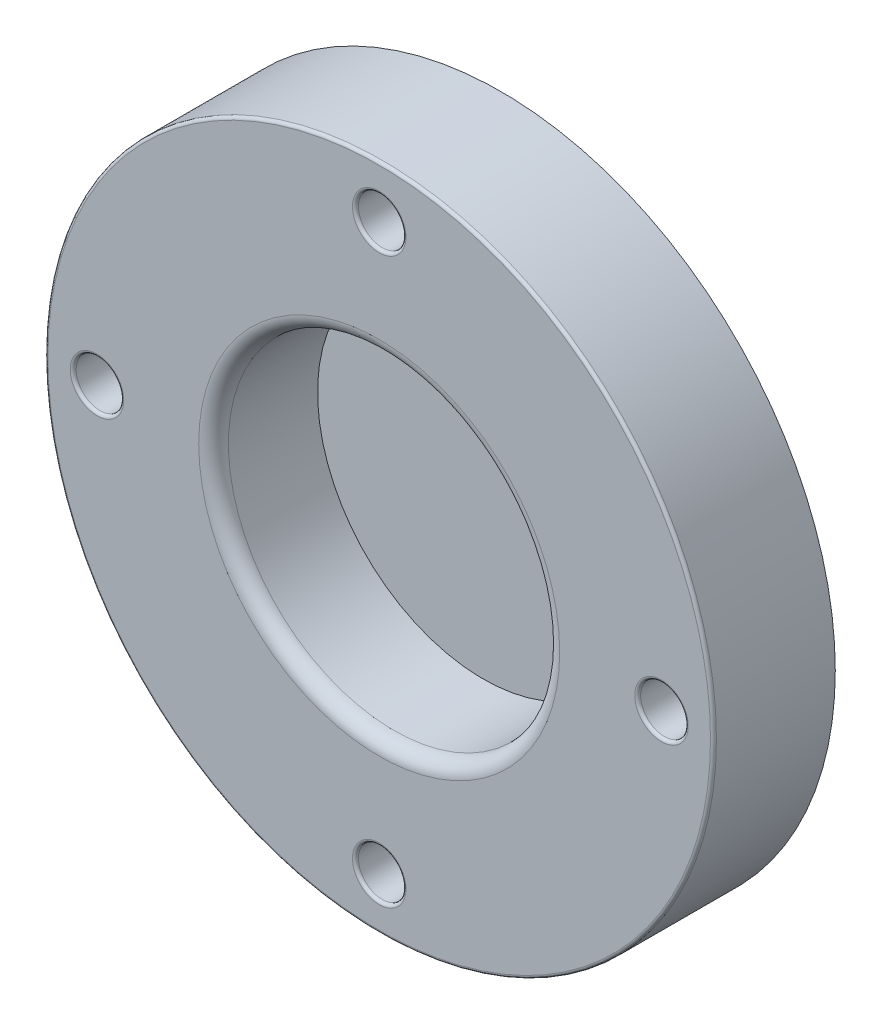
from build123d import *

# Parameters (mm, degrees)
SKETCH1_R           = 22.5
BOSS_EXTRUDE1_DEPTH = 8.2
SKETCH2_R           = 11.15
CUT_EXTRUDE1_DEPTH  = 7
SKETCH3_R           = 1.6
CUT_EXTRUDE2_DEPTH  = 33.859397438
FILLET1_R           = 1
FILLET2_R           = 0.2


with BuildPart() as part:
    # Sketch1 → Boss-Extrude1 (new body)
    with BuildSketch(Plane.XY):
        Circle(SKETCH1_R)
    extrude(amount=BOSS_EXTRUDE1_DEPTH)

    # Sketch2 → Cut-Extrude1 (cut)
    with BuildSketch(Plane.XY.offset(8.2)):
        Circle(SKETCH2_R)
    extrude(amount=-CUT_EXTRUDE1_DEPTH, mode=Mode.SUBTRACT)

    # Sketch3 → Cut-Extrude2 (cut, through all)
    with BuildSketch(Plane.XY.offset(8.2)):
        with Locations((-19, 0)):
            Circle(SKETCH3_R)
        with Locations((0, 19)):
            Circle(SKETCH3_R)
        with Locations((19, 0)):
            Circle(SKETCH3_R)
        with Locations((0, -19)):
            Circle(SKETCH3_R)
    extrude(amount=-CUT_EXTRUDE2_DEPTH, mode=Mode.SUBTRACT)

    # Fillet1
    fillet1_edges = [part.edges().sort_by_distance(p)[0] for p in [
        (-11.15, 0, 8.2),
    ]]
    fillet(fillet1_edges, radius=FILLET1_R)

    # Fillet2
    fillet2_edges = [part.edges().sort_by_distance(p)[0] for p in [
        (-20.6, 0, 8.2),
        (-1.6, 19, 8.2),
        (17.4, 0, 8.2),
        (-1.6, -19, 8.2),
        (-22.5, 0, 8.2),
    ]]
    fillet(fillet2_edges, radius=FILLET2_R)


solid = part.part
